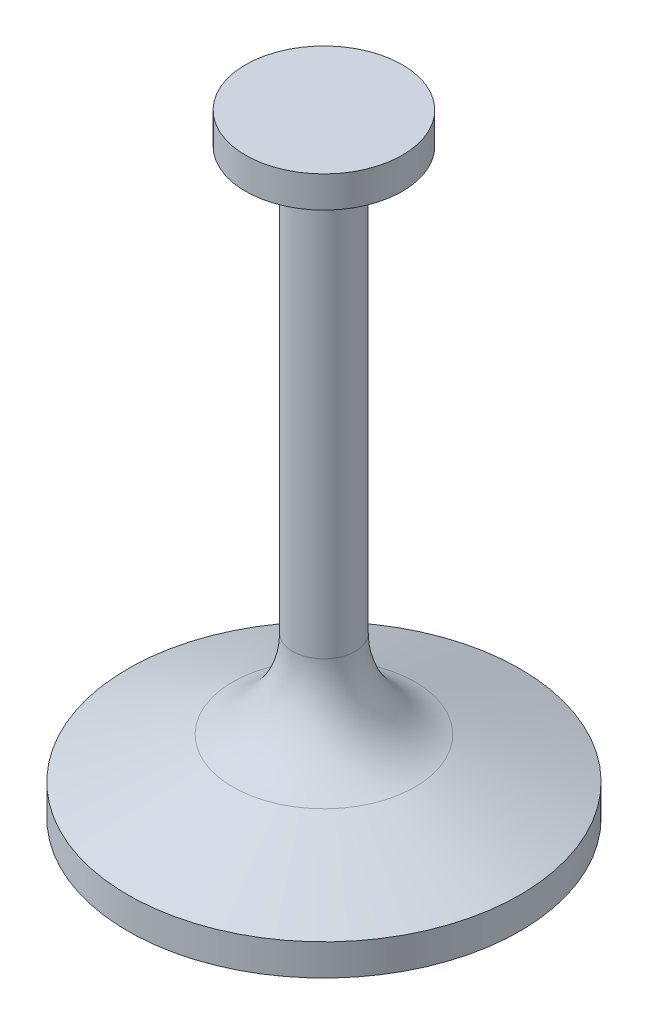
from build123d import *

# Parameters (mm, degrees)
FILLET1_R = 152.4


with BuildPart() as part:
    # Sketch1 → Revolve1 (revolve)
    with BuildSketch(Plane.XY, mode=Mode.PRIVATE) as revolve1_sk:
        with BuildLine():
            Line((0, 96.465824501), (0, 990.6))
            Line((0, 990.6), (127, 990.6))
            Line((127, 990.6), (127, 939.8))
            Line((127, 939.8), (50.8, 939.8))
            Line((50.8, 939.8), (50.8, 152.4))
            Line((50.8, 152.4), (317.5, 47.949488431))
            Line((317.5, 47.949488431), (317.5, -2.850511569))
            Line((317.5, -2.850511569), (266.7, -2.850511569))
            ThreePointArc((266.7, -2.850511569), (136.453128891, 55.140671034), (0, 96.465824501))
        make_face()
    revolve(revolve1_sk.sketch.rotate(Axis((0, 96.465824501, 0), (0, 1, 0)), 90), axis=Axis((0, 96.465824501, 0), (0, 1, 0)))

    # Fillet1
    fillet1_edges = [part.edges().sort_by_distance(p)[0] for p in [
        (0, 152.4, 50.8),
    ]]
    fillet(fillet1_edges, radius=FILLET1_R)


solid = part.part
